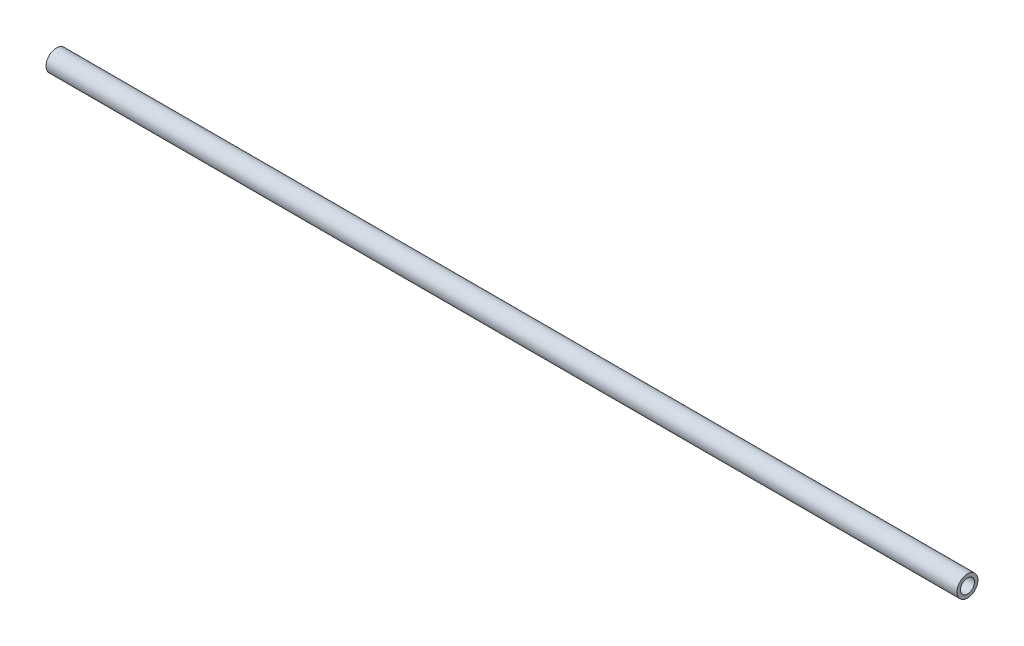
from build123d import *

# Parameters (mm, degrees)
SKETCH_1_R      = 1.5
SKETCH_1_R_2    = 1
EXTRUDE_1_DEPTH = 130


with BuildPart() as part:
    # 草图1 → 凸台-拉伸1 (new body)
    with BuildSketch(Plane(origin=(0, 0, 0), x_dir=(0, 0, -1), z_dir=(1, 0, 0))):
        Circle(SKETCH_1_R)
        Circle(SKETCH_1_R_2, mode=Mode.SUBTRACT)
    extrude(amount=EXTRUDE_1_DEPTH)


solid = part.part
